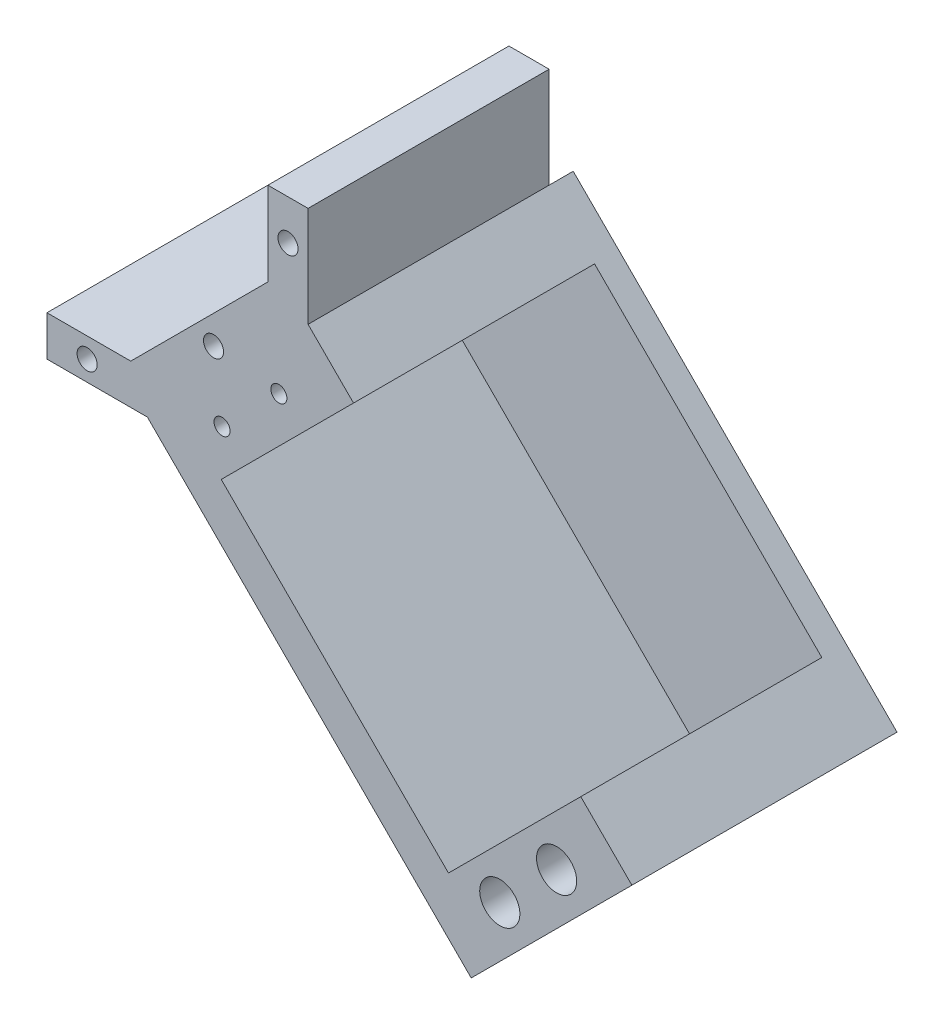
from build123d import *
from build123d.topology import SkipClean

# Parameters (mm, degrees)
MODEL_R             = 1
MODEL_R_2           = 1.25
BOSS_EXTRUDE1_DEPTH = 30
SKETCH3_R           = 2.5
BOSS_EXTRUDE2_DEPTH = 30
BOSS_EXTRUDE5_START = 3
SKETCH7_R           = 2.5
SKETCH7_R_2         = 1
BOSS_EXTRUDE5_DEPTH = 3
BOSS_EXTRUDE6_DEPTH = 3


with BuildPart() as part:
    # Model → Boss-Extrude1 (new body)
    # profile 1 of 2: a face of its own
    with BuildSketch(Plane.XY):
        Polygon((25.100694962, 10.3343272), (45.100694962, 30.3343272), (50.757549212, 24.67747295), (30.757549212, 4.67747295), align=None)
        with Locations((41.464655993, 21.041433981)):
            Circle(MODEL_R, mode=Mode.SUBTRACT)
        with Locations((34.393588181, 13.970366169)):
            Circle(MODEL_R, mode=Mode.SUBTRACT)
    # profile 2 of 2: a face of its own
    with BuildSketch(Plane.XY):
        Polygon((40.100694962, 42.8343272), (45.100694962, 42.8343272), (45.100694962, 30.3343272), (25.100694962, 10.3343272), (12.600694962, 10.3343272), (12.600694962, 15.3343272), (23.02962715, 15.3343272), (40.100694962, 32.405395011), align=None)
        with Locations((33.332928009, 22.102094153)):
            Circle(MODEL_R_2, mode=Mode.SUBTRACT)
        with Locations((42.600694962, 37.8343272)):
            Circle(MODEL_R_2, mode=Mode.SUBTRACT)
        with Locations((17.600694962, 12.8343272)):
            Circle(MODEL_R_2, mode=Mode.SUBTRACT)
    extrude(amount=BOSS_EXTRUDE1_DEPTH)

    # Sketch3 → Boss-Extrude2 (add)
    with BuildSketch(Plane(origin=(0, 0, 0), x_dir=(-1, 0, 0), z_dir=(0, 0, -1))):
        Polygon((-30.757549212, 4.67747295), (-59.041820459, -23.606798297), (-65.40578149, -29.970759328), (-85.40578149, -9.970759328), (-79.041820459, -3.606798297), (-62.577354365, -20.071264391), (-34.293083118, 8.213006856), align=None)
        with Locations((-76.033069792, -12.979509995)):
            Circle(SKETCH3_R, mode=Mode.SUBTRACT)
        with Locations((-68.96200198, -20.050577807)):
            Circle(SKETCH3_R, mode=Mode.SUBTRACT)
    extrude(amount=-BOSS_EXTRUDE2_DEPTH)

    # Sketch7 → Boss-Extrude5 (add)
    with SkipClean():  # the faces are left unmerged after this step: merging them gives an invalid solid
        with BuildSketch(Plane(origin=(0, 0, 0), x_dir=(-1, 0, 0), z_dir=(0, 0, -1)).offset(BOSS_EXTRUDE5_START)):
            Polygon((-45.100694962, 30.3343272), (-25.100694962, 10.3343272), (-65.40578149, -29.970759328), (-85.40578149, -9.970759328), (-79.041820459, -3.606798297), (-62.577354365, -20.071264391), (-34.293083118, 8.213006856), (-50.757549212, 24.67747295), align=None)
            with Locations((-68.96200198, -20.050577807)):
                Circle(SKETCH7_R, mode=Mode.SUBTRACT)
            with Locations((-76.033069792, -12.979509995)):
                Circle(SKETCH7_R, mode=Mode.SUBTRACT)
            with Locations((-34.393588181, 13.970366169)):
                Circle(SKETCH7_R_2, mode=Mode.SUBTRACT)
            with Locations((-41.464655993, 21.041433981)):
                Circle(SKETCH7_R_2, mode=Mode.SUBTRACT)
        extrude(amount=-BOSS_EXTRUDE5_DEPTH)

    # Sketch8 → Boss-Extrude6 (add)
    with SkipClean():  # the faces are left unmerged after this step: merging them gives an invalid solid
        with BuildSketch(Plane(origin=(0, 0, -3), x_dir=(-1, 0, 0), z_dir=(0, 0, -1))):
            Polygon((-50.757549212, 24.67747295), (-34.293083118, 8.213006856), (-62.577354365, -20.071264391), (-79.041820459, -3.606798297), align=None)
        extrude(amount=-BOSS_EXTRUDE6_DEPTH)


solid = part.part
